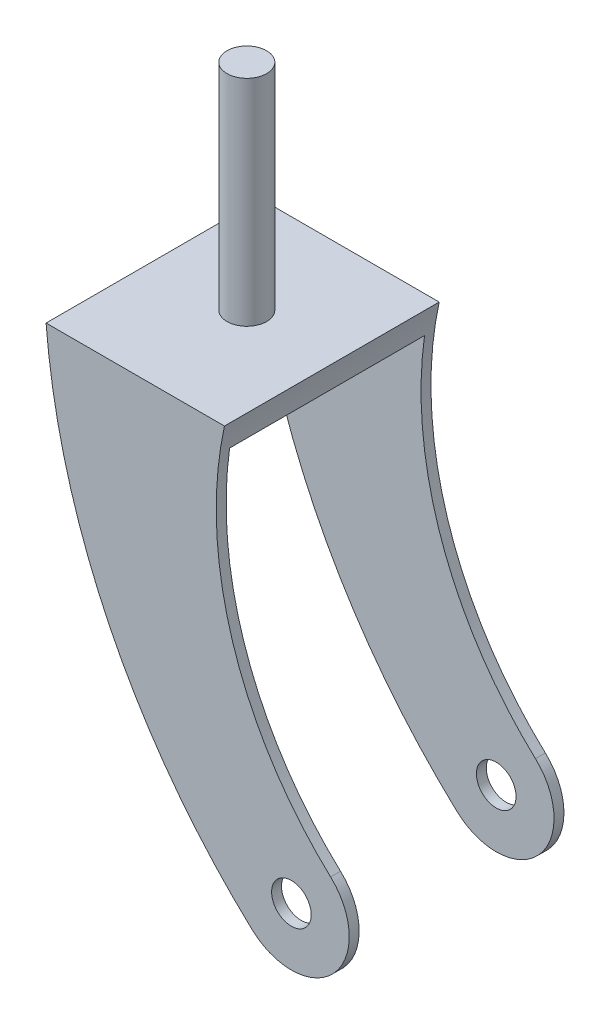
from build123d import *

# Parameters (mm, degrees)
CROQUIS1_R                 = 6
SALIENTE_EXTRUIR1_DEPTH    = 65
CORTAR_EXTRUIR1_DEPTH      = 148.783471464
CORTAR_EXTRUIR1_DEPTH_BACK = 148.783471464
CROQUIS2_W                 = 59
CROQUIS2_H                 = 249
CROQUIS3_R                 = 6
SALIENTE_EXTRUIR2_DEPTH    = 65


with BuildPart() as part:
    # Croquis1 → Saliente-Extruir1 (new body)
    with BuildSketch(Plane.XY):
        with BuildLine():
            Line((-74.262739229, 110), (-20.262739229, 110))
            ThreePointArc((-20.262739229, 110), (-17.790684157, 54.650853089), (11.872762465, 7.856419076))
            ThreePointArc((11.872762465, 7.856419076), (12.856419076, -16.872762465), (-11.872762465, -17.856419076))
            ThreePointArc((-11.872762465, -17.856419076), (-55.070234136, 40.214949961), (-74.262739229, 110))
        make_face()
        with Locations((0, -5)):
            Circle(CROQUIS1_R, mode=Mode.SUBTRACT)
    extrude(amount=SALIENTE_EXTRUIR1_DEPTH)

    # Croquis2 → Cortar-Extruir1 (cut, two sides: drawn at the far end of the back side and taken through both)
    with BuildSketch(Plane(origin=(0, 0, 0), x_dir=(0, 0, -1), z_dir=(1, 0, 0)).offset(-CORTAR_EXTRUIR1_DEPTH_BACK)):
        with Locations((-32.5, -22.5)):
            Rectangle(CROQUIS2_W, CROQUIS2_H)
    extrude(amount=CORTAR_EXTRUIR1_DEPTH + CORTAR_EXTRUIR1_DEPTH_BACK, mode=Mode.SUBTRACT)

    # Croquis3 → Saliente-Extruir2 (add)
    with BuildSketch(Plane(origin=(0, 110, 0), x_dir=(1, 0, 0), z_dir=(0, 1, 0))):
        with Locations((-47.262739229, -31.234778604)):
            Circle(CROQUIS3_R)
    extrude(amount=SALIENTE_EXTRUIR2_DEPTH)


solid = part.part
